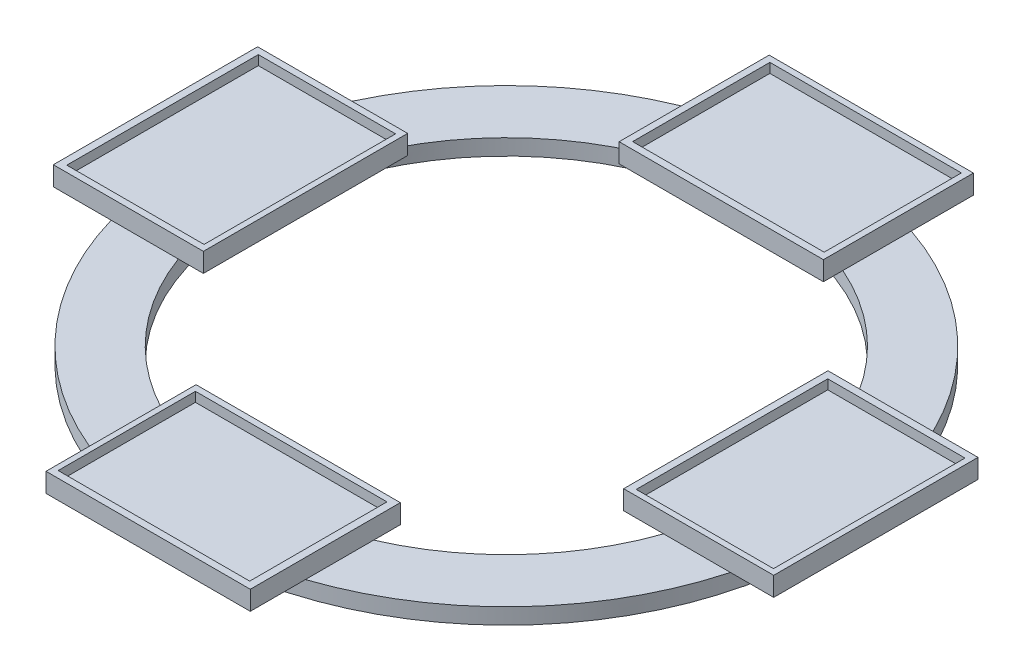
from build123d import *

# Parameters (mm, degrees)
SKETCH_1_R          = 100
EXTRUDE_2_DEPTH     = 5
SKETCH_3_R          = 80
CUT_EXTRUDE_1_DEPTH = 5
SKETCH_4_W          = 64
SKETCH_4_H          = 47
SKETCH_4_W_2        = 47
SKETCH_4_H_2        = 64
EXTRUDE_4_DEPTH     = 6
SKETCH_7_W          = 60
SKETCH_7_H          = 43
SKETCH_7_W_2        = 43
SKETCH_7_H_2        = 60
CUT_EXTRUDE_2_DEPTH = 3


with BuildPart() as part:
    # 草图1 → 凸台-拉伸2 (new body)
    with BuildSketch(Plane(origin=(0, 0, 0), x_dir=(1, 0, 0), z_dir=(0, 1, 0))):
        with Locations(Location((0, 0, 0), (0, 0, 270))):
            Circle(SKETCH_1_R)
    extrude(amount=EXTRUDE_2_DEPTH)

    # 草图3 → 切除-拉伸1 (cut)
    with BuildSketch(Plane(origin=(0, 5, 0), x_dir=(1, 0, 0), z_dir=(0, 1, 0))):
        with Locations(Location((0, 0, 0), (0, 0, 270))):
            Circle(SKETCH_3_R)
    extrude(amount=-CUT_EXTRUDE_1_DEPTH, mode=Mode.SUBTRACT)

    # 草图4 → 凸台-拉伸4 (add)
    with BuildSketch(Plane(origin=(0, 5, 0), x_dir=(1, 0, 0), z_dir=(0, 1, 0))):
        with Locations((-0.162859843, -88.550006354)):
            Rectangle(SKETCH_4_W, SKETCH_4_H)
        with Locations((0.19173376, 90.641323137)):
            Rectangle(SKETCH_4_W, SKETCH_4_H)
        with Locations((-90.690666059, 4.275289792)):
            Rectangle(SKETCH_4_W_2, SKETCH_4_H_2)
        with Locations((86.540113404, 5.715544521)):
            Rectangle(SKETCH_4_W_2, SKETCH_4_H_2)
    extrude(amount=EXTRUDE_4_DEPTH)

    # 草图7 → 切除-拉伸2 (cut)
    with BuildSketch(Plane(origin=(0, 11, 0), x_dir=(1, 0, 0), z_dir=(0, 1, 0))):
        with Locations((-0.461103179, -88.439082163)):
            Rectangle(SKETCH_7_W, SKETCH_7_H)
        with Locations((0.274660962, 90.782811556)):
            Rectangle(SKETCH_7_W, SKETCH_7_H)
        with Locations((86.697399142, 5.490846131)):
            Rectangle(SKETCH_7_W_2, SKETCH_7_H_2)
        with Locations((-90.460833893, 4.260878525)):
            Rectangle(SKETCH_7_W_2, SKETCH_7_H_2)
    extrude(amount=-CUT_EXTRUDE_2_DEPTH, mode=Mode.SUBTRACT)


solid = part.part
